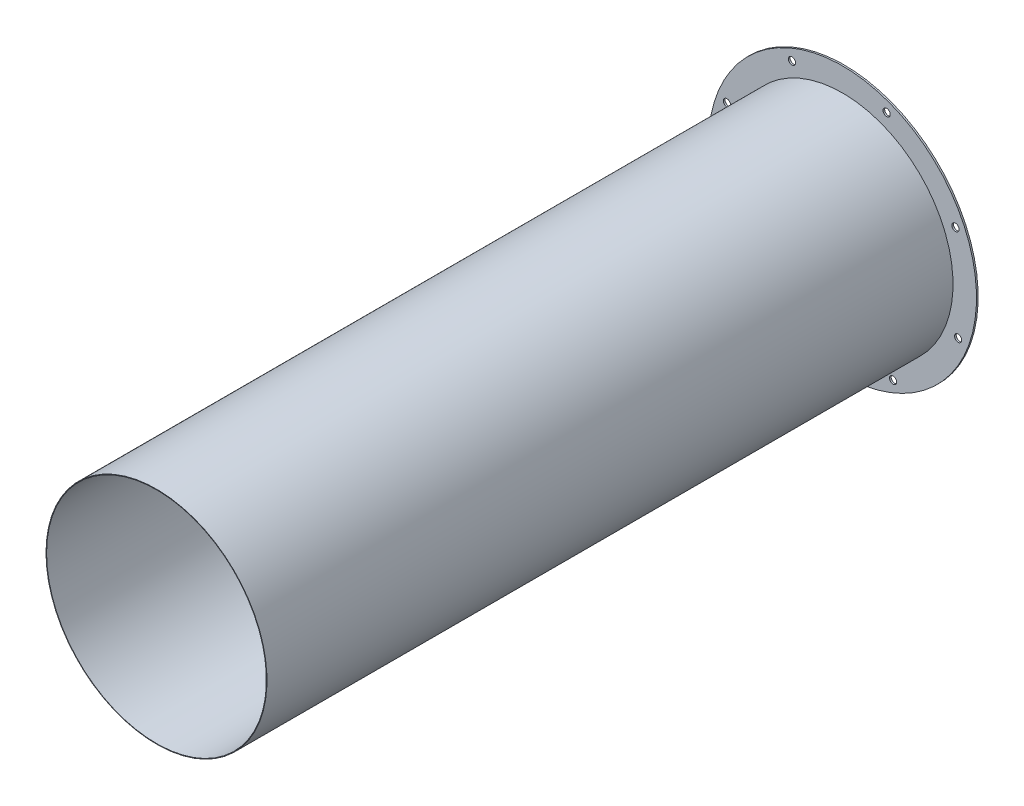
from build123d import *

# Parameters (mm, degrees)
SKETCH1_R           = 200
SKETCH1_R_2         = 199
EXTRUDE_THIN1_DEPTH = 622.5
SKETCH2_R           = 242.5
SKETCH2_R_2         = 200
EXTRUDE1_DEPTH      = 3
SKETCH3_R           = 6.5
CUT_EXTRUDE1_DEPTH  = 3
CIRPATTERN1_COUNT   = 8


with BuildPart() as part:
    # Sketch1 → Extrude-Thin1 (new, symmetric)
    with BuildSketch(Plane.XY):
        Circle(SKETCH1_R)
        Circle(SKETCH1_R_2, mode=Mode.SUBTRACT)
    extrude(amount=EXTRUDE_THIN1_DEPTH, both=True)


with BuildPart() as body_2:
    # Sketch2 → Extrude1 (new body)
    with BuildSketch(Plane(origin=(0, 0, -622.5), x_dir=(-1, 0, 0), z_dir=(0, 0, -1))):
        Circle(SKETCH2_R)
        Circle(SKETCH2_R_2, mode=Mode.SUBTRACT)
    extrude(amount=-EXTRUDE1_DEPTH)

    # Sketch3 → Cut-Extrude1 (cut)
    with BuildSketch(Plane.XY.offset(-619.5)):
        with Locations((209.286487732, -79.844636971)):
            Circle(SKETCH3_R)
    cut_extrude1 = extrude(amount=-CUT_EXTRUDE1_DEPTH, mode=Mode.SUBTRACT)

    # CirPattern1: Cut-Extrude1 ×8 about axis
    cirpattern1_axis = Axis((0, 0, 0), (0, 0, 1))
    for i in range(1, CIRPATTERN1_COUNT):
        add(cut_extrude1.rotate(cirpattern1_axis, i * 360 / CIRPATTERN1_COUNT), mode=Mode.SUBTRACT)


solid = Compound([part.part, body_2.part])
